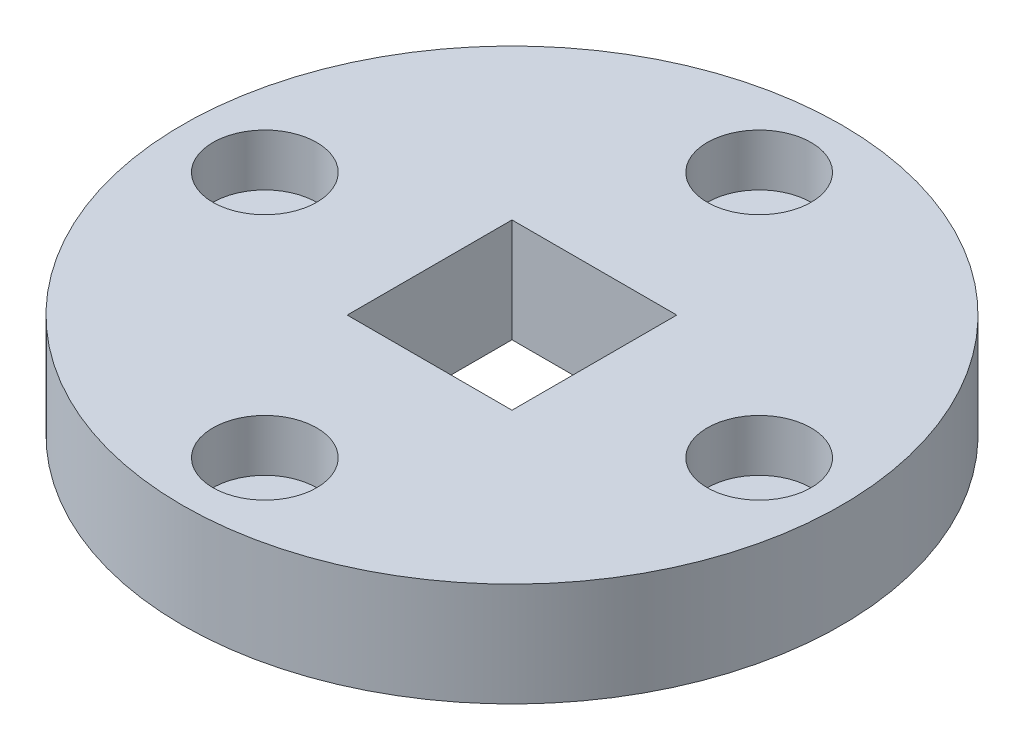
from build123d import *

# Parameters (mm, degrees)
SKETCH2_R           = 6.35
SKETCH2_W           = 3.175
SKETCH2_H           = 3.175
BOSS_EXTRUDE1_DEPTH = 2
SKETCH3_R           = 1
CUT_EXTRUDE1_DEPTH  = 1
CIRPATTERN1_COUNT   = 4


with BuildPart() as part:
    # Sketch2 → Boss-Extrude1 (new body)
    with BuildSketch(Plane(origin=(0, 0, 0), x_dir=(1, 0, 0), z_dir=(0, 1, 0))):
        with Locations(Location((0, 0, 0), (0, 0, 270))):
            Circle(SKETCH2_R)
        Rectangle(SKETCH2_W, SKETCH2_H, mode=Mode.SUBTRACT)
    extrude(amount=BOSS_EXTRUDE1_DEPTH)

    # Sketch3 → Cut-Extrude1 (cut)
    with BuildSketch(Plane(origin=(0, 2, 0), x_dir=(1, 0, 0), z_dir=(0, 1, 0))):
        with Locations(Location((-4.7625, 0, 0), (0, 0, 270))):
            Circle(SKETCH3_R)
    cut_extrude1 = extrude(amount=-CUT_EXTRUDE1_DEPTH, mode=Mode.SUBTRACT)

    # CirPattern1: Cut-Extrude1 ×4 about axis
    cirpattern1_axis = Axis((0, 0, 0), (0, 1, 0))
    for i in range(1, CIRPATTERN1_COUNT):
        add(cut_extrude1.rotate(cirpattern1_axis, i * 360 / CIRPATTERN1_COUNT), mode=Mode.SUBTRACT)


solid = part.part
